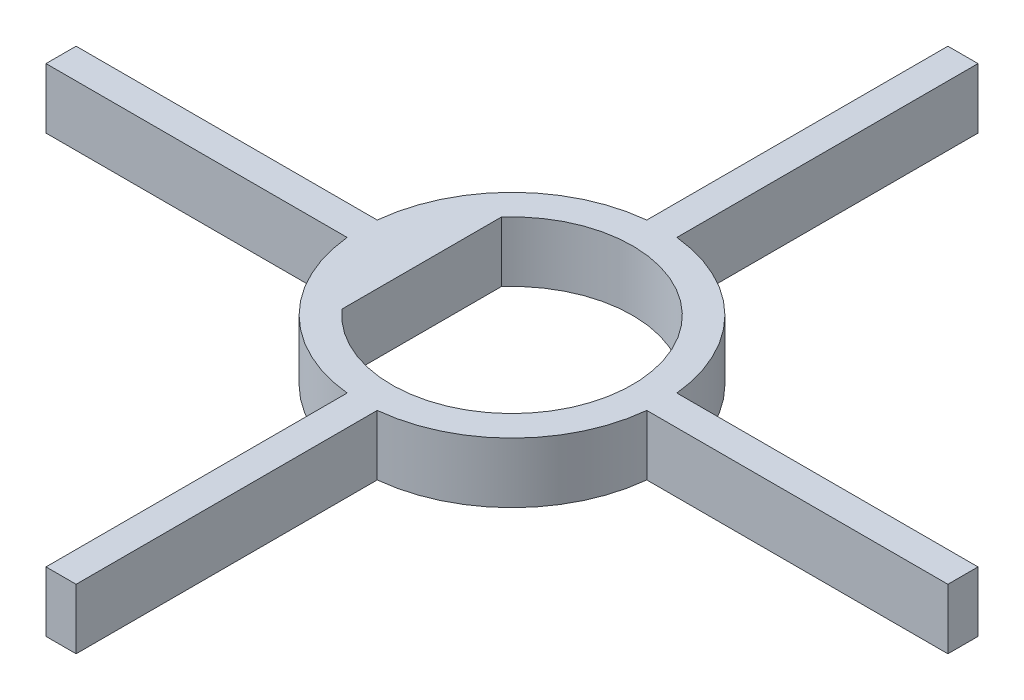
from build123d import *

# Parameters (mm, degrees)
BOSS_EXTRUDE1_DEPTH     = 2
CUT_EXTRUDE1_DEPTH      = 22.271988328
CUT_EXTRUDE1_DEPTH_BACK = 22.271988328


with BuildPart() as part:
    # Sketch1 → Boss-Extrude1 (new body)
    with BuildSketch(Plane(origin=(0, 0, 0), x_dir=(1, 0, 0), z_dir=(0, 1, 0))):
        with BuildLine():
            Line((-0.5, 4.974937186), (-0.5, 14.974937186))
            Line((-0.5, 14.974937186), (0.5, 14.974937186))
            Line((0.5, 14.974937186), (0.5, 4.974937186))
            ThreePointArc((0.5, 4.974937186), (3.535533906, 3.535533906), (4.974937186, 0.5))
            Line((4.974937186, 0.5), (14.974937186, 0.5))
            Line((14.974937186, 0.5), (14.974937186, -0.5))
            Line((14.974937186, -0.5), (4.974937186, -0.5))
            ThreePointArc((4.974937186, -0.5), (3.535533906, -3.535533906), (0.5, -4.974937186))
            Line((0.5, -4.974937186), (0.5, -14.974937186))
            Line((0.5, -14.974937186), (-0.5, -14.974937186))
            Line((-0.5, -14.974937186), (-0.5, -4.974937186))
            ThreePointArc((-0.5, -4.974937186), (-3.535533906, -3.535533906), (-4.974937186, -0.5))
            Line((-4.974937186, -0.5), (-14.974937186, -0.5))
            Line((-14.974937186, -0.5), (-14.974937186, 0.5))
            Line((-14.974937186, 0.5), (-4.974937186, 0.5))
            ThreePointArc((-4.974937186, 0.5), (-3.535533906, 3.535533906), (-0.5, 4.974937186))
        make_face()
    extrude(amount=BOSS_EXTRUDE1_DEPTH)

    # Sketch2 → Cut-Extrude1 (cut, two sides: drawn at the far end of the back side and taken through both)
    with BuildSketch(Plane(origin=(0, 0, 0), x_dir=(1, 0, 0), z_dir=(0, 1, 0)).offset(-CUT_EXTRUDE1_DEPTH_BACK)):
        with BuildLine():
            Line((-3, -2.645751311), (-3, 2.645751311))
            ThreePointArc((-3, 2.645751311), (4, 0), (-3, -2.645751311))
        make_face()
    extrude(amount=CUT_EXTRUDE1_DEPTH + CUT_EXTRUDE1_DEPTH_BACK, mode=Mode.SUBTRACT)


solid = part.part
